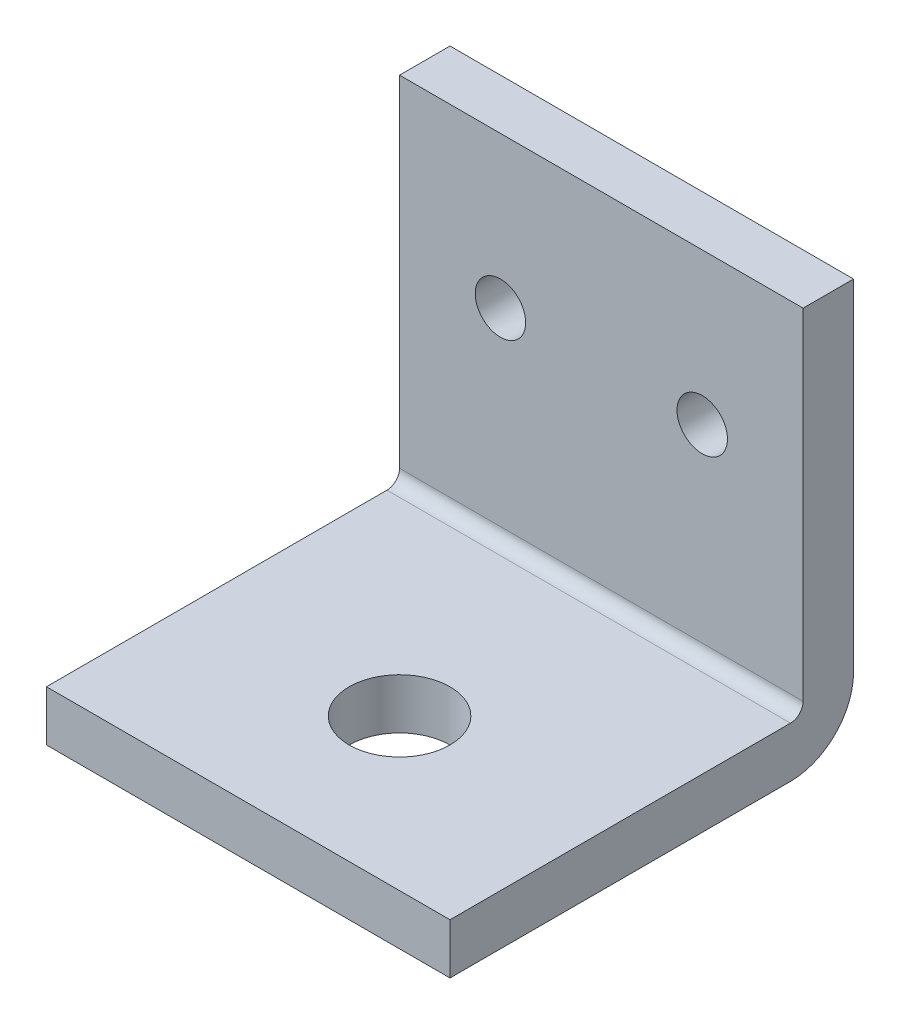
from build123d import *

# Parameters (mm, degrees)
SKETCH1_W           = 40
SKETCH1_H           = 40
BOSS_EXTRUDE1_DEPTH = 5
SKETCH2_W           = 40
SKETCH2_H           = 5
BOSS_EXTRUDE2_DEPTH = 35
SKETCH3_R           = 5
CUT_EXTRUDE1_DEPTH  = 35
SKETCH4_R           = 2.5
CUT_EXTRUDE2_DEPTH  = 35
FILLET1_R           = 1.25
FILLET2_R           = 6.25


with BuildPart() as part:
    # Sketch1 → Boss-Extrude1 (new body)
    with BuildSketch(Plane(origin=(0, 0, 0), x_dir=(1, 0, 0), z_dir=(0, 1, 0))):
        Rectangle(SKETCH1_W, SKETCH1_H)
    extrude(amount=BOSS_EXTRUDE1_DEPTH)

    # Sketch2 → Boss-Extrude2 (add)
    with BuildSketch(Plane(origin=(0, 5, 0), x_dir=(1, 0, 0), z_dir=(0, 1, 0))):
        with Locations((0, 17.5)):
            Rectangle(SKETCH2_W, SKETCH2_H)
    extrude(amount=BOSS_EXTRUDE2_DEPTH)

    # Sketch3 → Cut-Extrude1 (cut)
    with BuildSketch(Plane(origin=(0, 5, 0), x_dir=(1, 0, 0), z_dir=(0, 1, 0))):
        with Locations(Location((0, -5, 0), (0, 0, 270))):
            Circle(SKETCH3_R)
    extrude(amount=-CUT_EXTRUDE1_DEPTH, mode=Mode.SUBTRACT)

    # Sketch4 → Cut-Extrude2 (cut)
    with BuildSketch(Plane.XY.offset(-15)):
        with Locations((-10, 25)):
            Circle(SKETCH4_R)
        with Locations((10, 25)):
            Circle(SKETCH4_R)
    extrude(amount=-CUT_EXTRUDE2_DEPTH, mode=Mode.SUBTRACT)

    # Fillet1
    fillet1_edges = [part.edges().sort_by_distance(p)[0] for p in [
        (0, 5, -15),
    ]]
    fillet(fillet1_edges, radius=FILLET1_R)

    # Fillet2
    fillet2_edges = [part.edges().sort_by_distance(p)[0] for p in [
        (0, 0, -20),
    ]]
    fillet(fillet2_edges, radius=FILLET2_R)


solid = part.part
